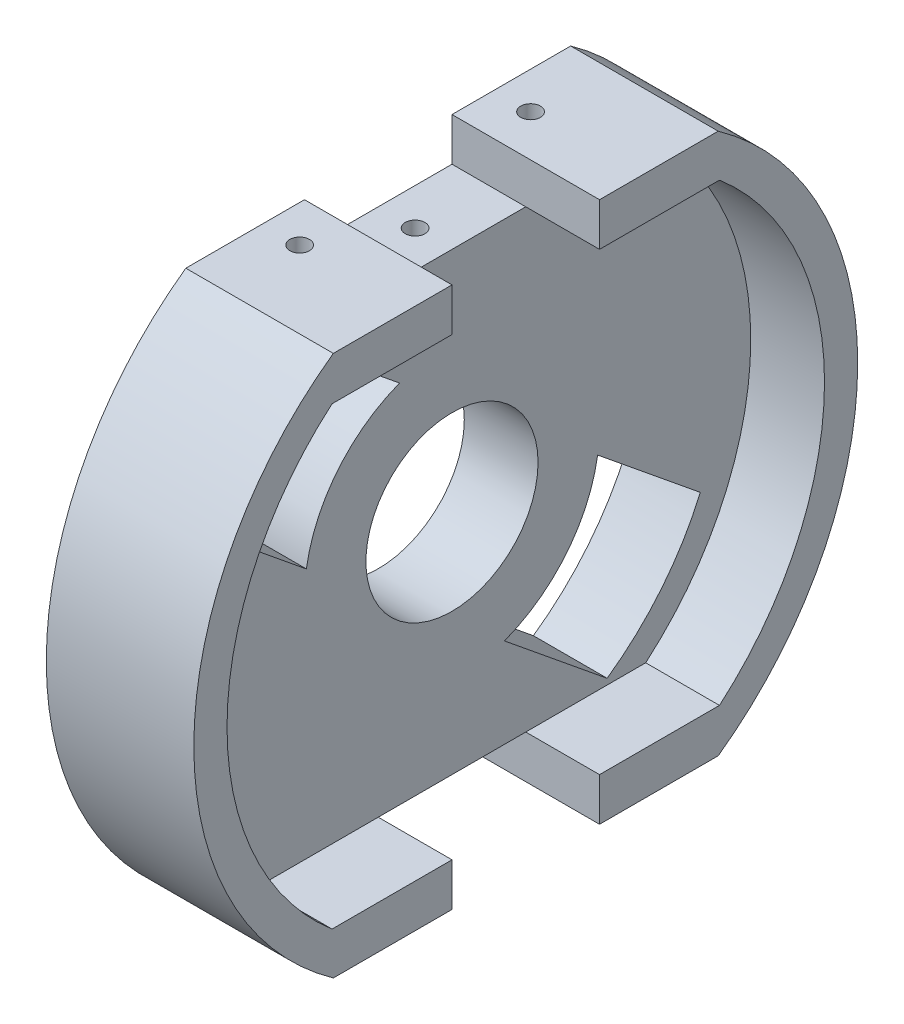
from build123d import *

# Parameters (mm, degrees)
EXTRUDE_1_DEPTH     = 3
EXTRUDE_2_DEPTH     = 3
SKETCH_3_W          = 6
SKETCH_3_H          = 6
CUT_EXTRUDE_1_DEPTH = 1.75
SKETCH_4_R          = 0.4
CUT_EXTRUDE_2_DEPTH = 3
CUT_EXTRUDE_START   = -20.25
SKETCH_3_2_W        = 6
SKETCH_3_2_H        = 6
CUT_EXTRUDE_3_DEPTH = 1.75
CUT_EXTRUDE_START_2 = -15.5
SKETCH_4_2_R        = 0.4
CUT_EXTRUDE_4_DEPTH = 3
SKETCH_5_R          = 0.4
CUT_EXTRUDE_5_DEPTH = 2


with BuildPart() as part:
    # 草图1 → 凸台-拉伸1 (new body)
    with BuildSketch(Plane(origin=(0, 0, 0), x_dir=(0, 0, -1), z_dir=(1, 0, 0))):
        with BuildLine():
            Line((0.497444108, 3.464469564), (-2.133220295, 5.607973892))
            ThreePointArc((-2.133220295, 5.607973892), (-4.651409913, 3.790037707), (-5.923258002, 0.956563979))
            Line((-5.923258002, 0.956563979), (-3.292593599, -1.186940349))
            ThreePointArc((-3.292593599, -1.186940349), (-2.713322449, 2.210855329), (0.497444108, 3.464469564))
        make_face()
        with BuildLine():
            Line((5.923258002, -0.956563979), (3.292593599, 1.186940349))
            ThreePointArc((3.292593599, 1.186940349), (3.447758518, 0.602462615), (3.5, 0))
            ThreePointArc((3.5, 0), (2.292263687, -2.644905894), (-0.497444108, -3.464469564))
            Line((-0.497444108, -3.464469564), (2.133220295, -5.607973892))
            ThreePointArc((2.133220295, -5.607973892), (4.651409913, -3.790037707), (5.923258002, -0.956563979))
        make_face()
        with BuildLine():
            ThreePointArc((6, 0), (3.405927057, 4.939601288), (-2.133220295, 5.607973892))
            Line((-2.133220295, 5.607973892), (0.497444108, 3.464469564))
            ThreePointArc((0.497444108, 3.464469564), (2.210855329, 2.713322449), (3.292593599, 1.186940349))
            Line((3.292593599, 1.186940349), (5.923258002, -0.956563979))
            ThreePointArc((5.923258002, -0.956563979), (5.980783728, -0.479818711), (6, 0))
        make_face()
        with BuildLine():
            Line((-3.292593599, -1.186940349), (-5.923258002, 0.956563979))
            ThreePointArc((-5.923258002, 0.956563979), (-3.790037707, -4.651409913), (2.133220295, -5.607973892))
            Line((2.133220295, -5.607973892), (-0.497444108, -3.464469564))
            ThreePointArc((-0.497444108, -3.464469564), (-2.210855329, -2.713322449), (-3.292593599, -1.186940349))
        make_face()
        with BuildLine():
            ThreePointArc((0, 11), (-3.307738334, 10.490894486), (-6.309297064, 9.010703111))
            Line((-6.309297064, 9.010703111), (-2.133220295, 5.607973892))
            ThreePointArc((-2.133220295, 5.607973892), (3.405927057, 4.939601288), (6, 0))
            ThreePointArc((6, 0), (5.980783728, -0.479818711), (5.923258002, -0.956563979))
            Line((5.923258002, -0.956563979), (10.099334771, -4.359293198))
            ThreePointArc((10.099334771, -4.359293198), (10.772480737, -2.22568164), (11, 0))
            ThreePointArc((11, 0), (7.778174593, 7.778174593), (0, 11))
        make_face()
        with BuildLine():
            Line((-5.923258002, 0.956563979), (-10.099334771, 4.359293198))
            ThreePointArc((-10.099334771, 4.359293198), (-9.191088775, -6.043499576), (-5.6e-08, -11))
            ThreePointArc((-5.6e-08, -11), (3.307738308, -10.490894494), (6.309297064, -9.010703111))
            Line((6.309297064, -9.010703111), (2.133220295, -5.607973892))
            ThreePointArc((2.133220295, -5.607973892), (-3.790037707, -4.651409913), (-5.923258002, 0.956563979))
        make_face()
        with BuildLine():
            Line((-10.099334771, 4.359293198), (-12.099007938, 5.98865652))
            ThreePointArc((-12.099007938, 5.98865652), (-13.145086665, 3.075174234), (-13.5, 5e-08))
            ThreePointArc((-13.5, 5e-08), (-11.998004261, -6.188529208), (-7.826237921, -11))
            Line((-7.826237921, -11), (-5.6e-08, -11))
            ThreePointArc((-5.6e-08, -11), (-9.191088775, -6.043499576), (-10.099334771, 4.359293198))
        make_face()
        with BuildLine():
            ThreePointArc((6.309297064, -9.010703111), (3.307738308, -10.490894494), (-5.6e-08, -11))
            Line((-5.6e-08, -11), (7.826237921, -11))
            ThreePointArc((7.826237921, -11), (8.069611117, -10.822725), (8.308970231, -10.640066433))
            Line((8.308970231, -10.640066433), (6.309297064, -9.010703111))
        make_face()
        with BuildLine():
            ThreePointArc((-7.826237921, 11), (-8.069611117, 10.822725), (-8.308970231, 10.640066433))
            Line((-8.308970231, 10.640066433), (-6.309297064, 9.010703111))
            ThreePointArc((-6.309297064, 9.010703111), (-3.307738334, 10.490894486), (0, 11))
            Line((0, 11), (-7.826237921, 11))
        make_face()
        with BuildLine():
            Line((7.826237921, 11), (0, 11))
            ThreePointArc((0, 11), (7.778174593, 7.778174593), (11, 0))
            ThreePointArc((11, 0), (10.772480737, -2.22568164), (10.099334771, -4.359293198))
            Line((10.099334771, -4.359293198), (12.099007938, -5.98865652))
            ThreePointArc((12.099007938, -5.98865652), (13.145086671, -3.075174209), (13.5, 0))
            ThreePointArc((13.5, 0), (11.998004249, 6.18852923), (7.826237921, 11))
        make_face()
        with BuildLine():
            Line((-6.309297064, 9.010703111), (-8.308970231, 10.640066433))
            ThreePointArc((-8.308970231, 10.640066433), (-10.465672304, 8.527584841), (-12.099007938, 5.98865652))
            Line((-12.099007938, 5.98865652), (-10.099334771, 4.359293198))
            ThreePointArc((-10.099334771, 4.359293198), (-8.527584841, 6.948402463), (-6.309297064, 9.010703111))
        make_face()
        with BuildLine():
            Line((12.099007938, -5.98865652), (10.099334771, -4.359293198))
            ThreePointArc((10.099334771, -4.359293198), (8.527584841, -6.948402463), (6.309297064, -9.010703111))
            Line((6.309297064, -9.010703111), (8.308970231, -10.640066433))
            ThreePointArc((8.308970231, -10.640066433), (10.465672304, -8.527584841), (12.099007938, -5.98865652))
        make_face()
    extrude(amount=EXTRUDE_1_DEPTH)

    # 草图2 → 凸台-拉伸2 (add)
    with BuildSketch(Plane(origin=(3, 0, 0), x_dir=(0, 0, -1), z_dir=(1, 0, 0))):
        with BuildLine():
            ThreePointArc((-5.159699604, 11), (-6.577220881, 10.215804691), (-7.877816956, 9.25))
            Line((-7.877816956, 9.25), (7.877816956, 9.25))
            ThreePointArc((7.877816956, 9.25), (6.577220881, 10.215804691), (5.159699604, 11))
            Line((5.159699604, 11), (-5.159699604, 11))
        make_face()
        with BuildLine():
            Line((-9.83298022, 9.25), (-7.877816956, 9.25))
            ThreePointArc((-7.877816956, 9.25), (-6.577220881, 10.215804691), (-5.159699604, 11))
            Line((-5.159699604, 11), (-7.826237921, 11))
            ThreePointArc((-7.826237921, 11), (-8.87285869, 10.174594767), (-9.83298022, 9.25))
        make_face()
        with BuildLine():
            Line((-12.15, 5.884513574), (-12.15, 2.4e-08))
            ThreePointArc((-12.15, 2.4e-08), (-11.030366626, 5.09445896), (-7.877816956, 9.25))
            Line((-7.877816956, 9.25), (-9.83298022, 9.25))
            ThreePointArc((-9.83298022, 9.25), (-11.119553928, 7.65542425), (-12.15, 5.884513574))
        make_face()
        with BuildLine():
            ThreePointArc((-13.5, -2.2e-08), (-13.158172363, -3.01869178), (-12.15, -5.884513574))
            Line((-12.15, -5.884513574), (-12.15, 2.4e-08))
            Line((-12.15, 2.4e-08), (-12.15, 5.884513574))
            ThreePointArc((-12.15, 5.884513574), (-13.158172368, 3.018691759), (-13.5, -2.2e-08))
        make_face()
        with BuildLine():
            ThreePointArc((-12.15, -5.884513574), (-11.119553928, -7.65542425), (-9.83298022, -9.25))
            Line((-9.83298022, -9.25), (-7.877816956, -9.25))
            ThreePointArc((-7.877816956, -9.25), (-11.030366636, -5.094458939), (-12.15, 2.4e-08))
            Line((-12.15, 2.4e-08), (-12.15, -5.884513574))
        make_face()
        with BuildLine():
            Line((-7.877816956, -9.25), (-9.83298022, -9.25))
            ThreePointArc((-9.83298022, -9.25), (-8.87285869, -10.174594767), (-7.826237921, -11))
            Line((-7.826237921, -11), (-5.159699604, -11))
            ThreePointArc((-5.159699604, -11), (-6.577220881, -10.215804691), (-7.877816956, -9.25))
        make_face()
        with BuildLine():
            Line((7.877816956, -9.25), (-7.877816956, -9.25))
            ThreePointArc((-7.877816956, -9.25), (-6.577220881, -10.215804691), (-5.159699604, -11))
            Line((-5.159699604, -11), (5.159699604, -11))
            ThreePointArc((5.159699604, -11), (6.577220881, -10.215804691), (7.877816956, -9.25))
        make_face()
        with BuildLine():
            Line((9.83298022, -9.25), (7.877816956, -9.25))
            ThreePointArc((7.877816956, -9.25), (6.577220881, -10.215804691), (5.159699604, -11))
            Line((5.159699604, -11), (7.826237921, -11))
            ThreePointArc((7.826237921, -11), (8.87285869, -10.174594767), (9.83298022, -9.25))
        make_face()
        with BuildLine():
            ThreePointArc((12.15, 0), (11.030366631, -5.09445895), (7.877816956, -9.25))
            Line((7.877816956, -9.25), (9.83298022, -9.25))
            ThreePointArc((9.83298022, -9.25), (11.119553928, -7.65542425), (12.15, -5.884513574))
            Line((12.15, -5.884513574), (12.15, 0))
        make_face()
        with BuildLine():
            Line((12.15, 5.884513574), (12.15, 0))
            Line((12.15, 0), (12.15, -5.884513574))
            ThreePointArc((12.15, -5.884513574), (13.158172365, -3.01869177), (13.5, 0))
            ThreePointArc((13.5, 0), (13.158172365, 3.01869177), (12.15, 5.884513574))
        make_face()
        with BuildLine():
            ThreePointArc((7.877816956, 9.25), (11.030366631, 5.09445895), (12.15, 0))
            Line((12.15, 0), (12.15, 5.884513574))
            ThreePointArc((12.15, 5.884513574), (11.119553928, 7.65542425), (9.83298022, 9.25))
            Line((9.83298022, 9.25), (7.877816956, 9.25))
        make_face()
        with BuildLine():
            ThreePointArc((5.159699604, 11), (6.577220881, 10.215804691), (7.877816956, 9.25))
            Line((7.877816956, 9.25), (9.83298022, 9.25))
            ThreePointArc((9.83298022, 9.25), (8.87285869, 10.174594767), (7.826237921, 11))
            Line((7.826237921, 11), (5.159699604, 11))
        make_face()
    extrude(amount=EXTRUDE_2_DEPTH)

    # 草图3 → 切除-拉伸1 (cut)
    with BuildSketch(Plane(origin=(0, 11, 0), x_dir=(1, 0, 0), z_dir=(0, 1, 0))):
        with Locations((3, 0)):
            Rectangle(SKETCH_3_W, SKETCH_3_H)
    extrude(amount=-CUT_EXTRUDE_1_DEPTH, mode=Mode.SUBTRACT)

    # 草图4 → 切除-拉伸2 (cut)
    with BuildSketch(Plane(origin=(0, 9.25, 0), x_dir=(1, 0, 0), z_dir=(0, 1, 0))):
        with Locations(Location((1.5, 0, 0), (0, 0, 270))):
            Circle(SKETCH_4_R)
    extrude(amount=-CUT_EXTRUDE_2_DEPTH, mode=Mode.SUBTRACT)

    # 草图3<2> → 切除-拉伸3 (cut)
    with BuildSketch(Plane(origin=(0, 11, 0), x_dir=(1, 0, 0), z_dir=(0, 1, 0)).offset(CUT_EXTRUDE_START)):
        with Locations((3, 0)):
            Rectangle(SKETCH_3_2_W, SKETCH_3_2_H)
    extrude(amount=-CUT_EXTRUDE_3_DEPTH, mode=Mode.SUBTRACT)

    # 草图4<2> → 切除-拉伸4 (cut)
    with BuildSketch(Plane(origin=(0, 9.25, 0), x_dir=(1, 0, 0), z_dir=(0, 1, 0)).offset(CUT_EXTRUDE_START_2)):
        with Locations(Location((1.5, 0, 0), (0, 0, 270))):
            Circle(SKETCH_4_2_R)
    extrude(amount=-CUT_EXTRUDE_4_DEPTH, mode=Mode.SUBTRACT)

    # 草图5 → 切除-拉伸5 (cut)
    with BuildSketch(Plane(origin=(0, 11, 0), x_dir=(1, 0, 0), z_dir=(0, 1, 0))):
        with Locations(Location((1.5, -4.695742753, 0), (0, 0, 270))):
            Circle(SKETCH_5_R)
        with Locations(Location((1.5, 4.695742753, 0), (0, 0, 270))):
            Circle(SKETCH_5_R)
    extrude(amount=-CUT_EXTRUDE_5_DEPTH, mode=Mode.SUBTRACT)


solid = part.part
